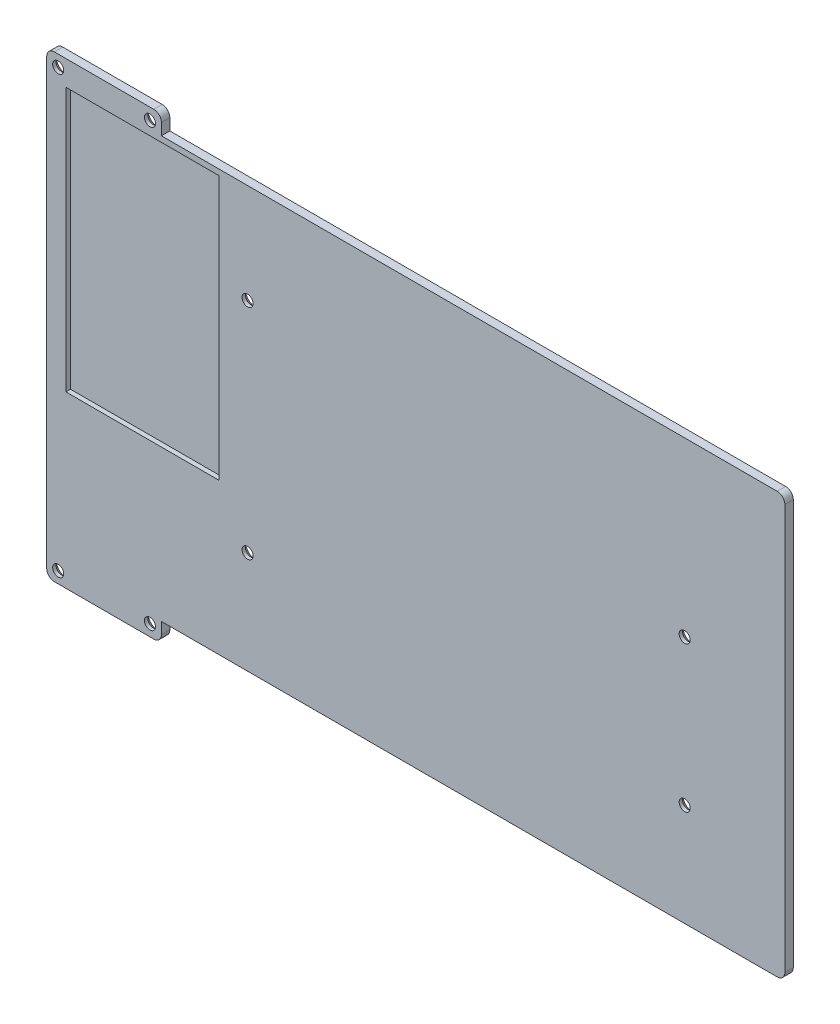
from build123d import *

# Parameters (mm, degrees)
BOSS_EXTRUDE1_DEPTH                            = 2.2
CSK_FOR_M2_5_COUNTERSUNK_FLAT_HEAD_S_2_COUNT   = 2
CSK_FOR_M2_5_COUNTERSUNK_FLAT_HEAD_S_2_PITCH   = 115.901286123
CSK_FOR_M2_5_COUNTERSUNK_FLAT_HEAD_S_3_COUNT   = 2
CSK_FOR_M2_5_COUNTERSUNK_FLAT_HEAD_S_3_PITCH   = 127.813646083
CSK_FOR_M2_5_COUNTERSUNK_FLAT_HEAD_S_4_COUNT   = 2
CSK_FOR_M2_5_COUNTERSUNK_FLAT_HEAD_S_4_PITCH   = 57.15
CSK_FOR_M2_5_COUNTERSUNK_FLAT_HEAD_S_5_A_COUNT = 2
CSK_FOR_M2_5_COUNTERSUNK_FLAT_HEAD_S_5_A_PITCH = 24
CSK_FOR_M2_5_COUNTERSUNK_FLAT_HEAD_S_6_COUNT   = 2
CSK_FOR_M2_5_COUNTERSUNK_FLAT_HEAD_S_6_PITCH   = 114
CSK_FOR_M2_5_COUNTERSUNK_FLAT_HEAD_S_7_COUNT   = 2
CSK_FOR_M2_5_COUNTERSUNK_FLAT_HEAD_S_7_PITCH   = 116.498927034
CUT_EXTRUDE1_DEPTH                             = 161.482952565
CUT_EXTRUDE1_DEPTH_BACK                        = 1.2
SKETCH4_W                                      = 40
SKETCH4_H                                      = 69


with BuildPart() as part:
    # Sketch1 → Boss-Extrude1 (new body)
    with BuildSketch(Plane.XY):
        with BuildLine():
            Line((-129.172572744, -27.567893977), (-103.172572744, -27.567893977))
            ThreePointArc((-103.172572744, -27.567893977), (-101.758359182, -26.98210754), (-101.172572744, -25.567893977))
            Line((-101.172572744, -25.567893977), (-101.172572744, -22.567893977))
            Line((-101.172572744, -22.567893977), (59.877427256, -22.567893977))
            ThreePointArc((59.877427256, -22.567893977), (61.291640818, -21.98210754), (61.877427256, -20.567893977))
            Line((61.877427256, -20.567893977), (61.877427256, 85.432106023))
            ThreePointArc((61.877427256, 85.432106023), (61.291640818, 86.846319585), (59.877427256, 87.432106023))
            Line((59.877427256, 87.432106023), (-101.172572744, 87.432106023))
            Line((-101.172572744, 87.432106023), (-101.172572744, 90.432106023))
            ThreePointArc((-101.172572744, 90.432106023), (-101.758359182, 91.846319585), (-103.172572744, 92.432106023))
            Line((-103.172572744, 92.432106023), (-129.172572744, 92.432106023))
            ThreePointArc((-129.172572744, 92.432106023), (-130.586786306, 91.846319585), (-131.172572744, 90.432106023))
            Line((-131.172572744, 90.432106023), (-131.172572744, -25.567893977))
            ThreePointArc((-131.172572744, -25.567893977), (-130.586786306, -26.98210754), (-129.172572744, -27.567893977))
        make_face()
    extrude(amount=BOSS_EXTRUDE1_DEPTH)

    # Sketch2 → CSK for M2.5 Countersunk Flat Head Screw (revolve, cut)
    with BuildSketch(Plane(origin=(-78.647572744, 61.391992259, 0), x_dir=(0, 1, 0), z_dir=(1, 0, 0))):
        Polygon((0, 0), (0, 2.2), (1.45, 2.2), (1.45, 1.3), (2.75, 0), align=None)
    csk_for_m2_5_countersunk_flat_head_screw = revolve(axis=Axis((-78.647572744, 61.391992259, -6.35), (0, 0, 1)), mode=Mode.SUBTRACT)

    # CSK for M2.5 Countersunk Flat Head S 2: CSK for M2.5 Countersunk Flat Head Screw ×2
    with Locations(*[Vector(0.9863997529632768, -0.1643640086940774, 0) * (i * CSK_FOR_M2_5_COUNTERSUNK_FLAT_HEAD_S_2_PITCH) for i in range(1, CSK_FOR_M2_5_COUNTERSUNK_FLAT_HEAD_S_2_COUNT)]):
        add(csk_for_m2_5_countersunk_flat_head_screw, mode=Mode.SUBTRACT)

    # CSK for M2.5 Countersunk Flat Head S 3: CSK for M2.5 Countersunk Flat Head Screw ×2
    with Locations(*[Vector(0.8944663070316109, -0.447135354881754, 0) * (i * CSK_FOR_M2_5_COUNTERSUNK_FLAT_HEAD_S_3_PITCH) for i in range(1, CSK_FOR_M2_5_COUNTERSUNK_FLAT_HEAD_S_3_COUNT)]):
        add(csk_for_m2_5_countersunk_flat_head_screw, mode=Mode.SUBTRACT)

    # CSK for M2.5 Countersunk Flat Head S 4: CSK for M2.5 Countersunk Flat Head Screw ×2
    with Locations(*[(0, -i * CSK_FOR_M2_5_COUNTERSUNK_FLAT_HEAD_S_4_PITCH, 0) for i in range(1, CSK_FOR_M2_5_COUNTERSUNK_FLAT_HEAD_S_4_COUNT)]):
        add(csk_for_m2_5_countersunk_flat_head_screw, mode=Mode.SUBTRACT)

    # Sketch3 → CSK for M2.5 Countersunk Flat Head S 5 (revolve, cut)
    with BuildSketch(Plane(origin=(-104.172572744, 89.432106023, 0), x_dir=(0, 1, 0), z_dir=(1, 0, 0))):
        Polygon((0, 0), (0, 2.2), (1.45, 2.2), (1.45, 1.3), (2.75, 0), align=None)
    csk_for_m2_5_countersunk_flat_head_s_5 = revolve(axis=Axis((-104.172572744, 89.432106023, -6.35), (0, 0, 1)), mode=Mode.SUBTRACT)

    # CSK for M2.5 Countersunk Flat Head S 5 a: CSK for M2.5 Countersunk Flat Head S 5 ×2
    with Locations(*[(-i * CSK_FOR_M2_5_COUNTERSUNK_FLAT_HEAD_S_5_A_PITCH, 0, 0) for i in range(1, CSK_FOR_M2_5_COUNTERSUNK_FLAT_HEAD_S_5_A_COUNT)]):
        add(csk_for_m2_5_countersunk_flat_head_s_5, mode=Mode.SUBTRACT)

    # CSK for M2.5 Countersunk Flat Head S 6: CSK for M2.5 Countersunk Flat Head S 5 ×2
    with Locations(*[(0, -i * CSK_FOR_M2_5_COUNTERSUNK_FLAT_HEAD_S_6_PITCH, 0) for i in range(1, CSK_FOR_M2_5_COUNTERSUNK_FLAT_HEAD_S_6_COUNT)]):
        add(csk_for_m2_5_countersunk_flat_head_s_5, mode=Mode.SUBTRACT)

    # CSK for M2.5 Countersunk Flat Head S 7: CSK for M2.5 Countersunk Flat Head S 5 ×2
    with Locations(*[Vector(-0.20601048104984218, -0.9785497849867489, 0) * (i * CSK_FOR_M2_5_COUNTERSUNK_FLAT_HEAD_S_7_PITCH) for i in range(1, CSK_FOR_M2_5_COUNTERSUNK_FLAT_HEAD_S_7_COUNT)]):
        add(csk_for_m2_5_countersunk_flat_head_s_5, mode=Mode.SUBTRACT)

    # Sketch4 → Cut-Extrude1 (cut, two sides: drawn at the far end of the back side and taken through both)
    with BuildSketch(Plane.XY.offset(2.2).offset(-CUT_EXTRUDE1_DEPTH_BACK)):
        with Locations((-106.172572744, 51.432106023)):
            Rectangle(SKETCH4_W, SKETCH4_H)
    extrude(amount=CUT_EXTRUDE1_DEPTH + CUT_EXTRUDE1_DEPTH_BACK, mode=Mode.SUBTRACT)


solid = part.part
